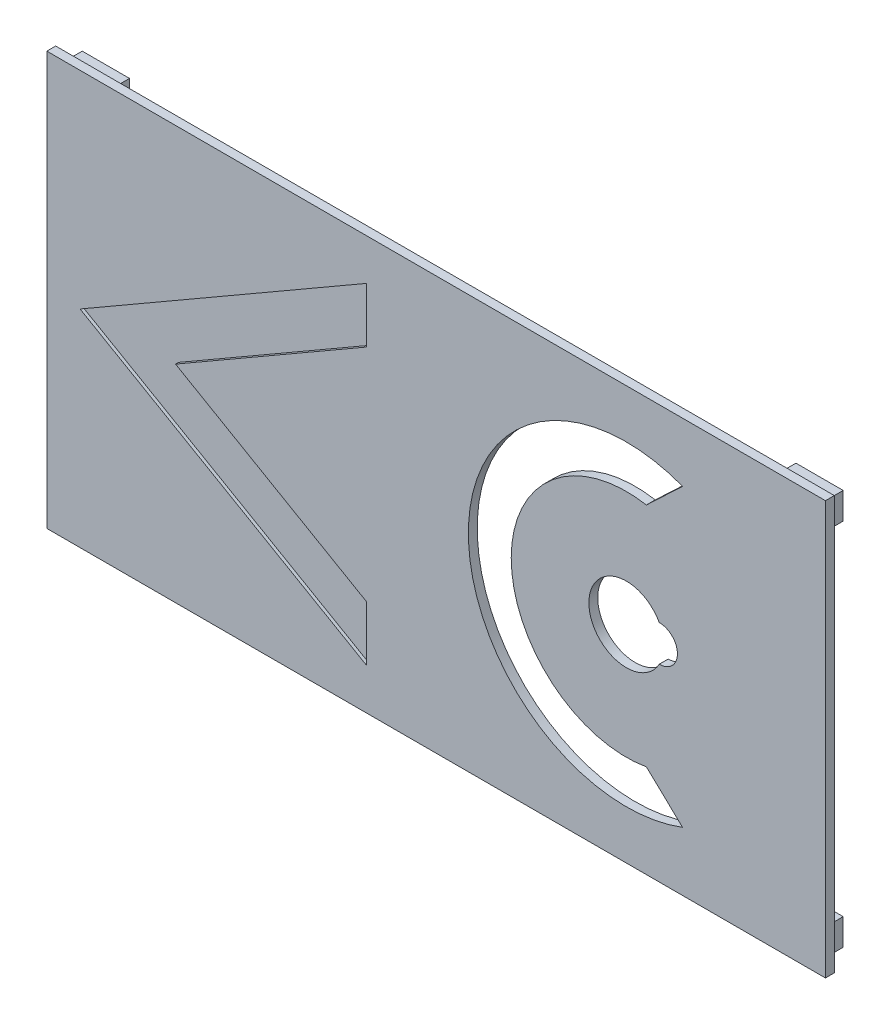
from build123d import *

# Parameters (mm, degrees)
SKETCH1_W                 = 131.85
SKETCH1_H                 = 70
BOSS_EXTRUDE1_DEPTH       = 1.5
CUT_EXTRUDE1_REACH        = 137.268
SKETCH4_W                 = 8
SKETCH4_H                 = 4.5
SKETCH4_W_2               = 5
SKETCH4_H_2               = 1.5
BOSS_EXTRUDE2_DEPTH       = 3
MIRROR2_COPY_1_SKETCH_W   = 8
MIRROR2_COPY_1_SKETCH_H   = 4.5
MIRROR2_COPY_1_SKETCH_W_2 = 5
MIRROR2_COPY_1_SKETCH_H_2 = 1.5
MIRROR2_COPY_1_DEPTH      = 3
CUT_EXTRUDE2_REACH        = 137.335
CUT_EXTRUDE3_DEPTH        = 0.5


with BuildPart() as part:
    # Sketch1 → Boss-Extrude1 (new body)
    with BuildSketch(Plane.XY):
        with Locations((55.175, 25.25)):
            Rectangle(SKETCH1_W, SKETCH1_H)
    extrude(amount=BOSS_EXTRUDE1_DEPTH)

    # Sketch2 → Cut-Extrude1 (cut, up to next)
    with BuildSketch(Plane.XY.offset(1.5), mode=Mode.PRIVATE) as cut_extrude1_sk1:
        with BuildLine():
            Line((92.957060126, 22.2), (92.9875, 22.2))
            ThreePointArc((92.9875, 22.2), (96.0375, 25.25), (92.9875, 28.3))
            Line((92.9875, 28.3), (92.957060126, 28.3))
            ThreePointArc((92.957060126, 28.3), (81.0375, 25.25), (92.957060126, 22.2))
        make_face()
    cut_extrude1_tool1 = extrude(cut_extrude1_sk1.sketch, amount=-CUT_EXTRUDE1_REACH, mode=Mode.PRIVATE) & part.part
    add(cut_extrude1_tool1.solids().sort_by_distance((87.98685, 25.25, 1.5))[0], mode=Mode.SUBTRACT)

    # Sketch4 → Boss-Extrude2 (add)
    with BuildSketch(Plane(origin=(0, 0, 0), x_dir=(-1, 0, 0), z_dir=(0, 0, -1))):
        with Locations((-115.6, 56.5)):
            Rectangle(SKETCH4_W, SKETCH4_H)
        with Locations((-115.6, 56.5)):
            Rectangle(SKETCH4_W_2, SKETCH4_H_2, mode=Mode.SUBTRACT)
    boss_extrude2 = extrude(amount=BOSS_EXTRUDE2_DEPTH)

    # Mirror1: Boss-Extrude2 across plane
    add(boss_extrude2.mirror(Plane.ZX.offset(25.25)))

    # Mirror2: Boss-Extrude2 across plane
    add(boss_extrude2.mirror(Plane(origin=(55.175, 0, 0), x_dir=(0, 0, 1), z_dir=(1, 0, 0))))

    # Mirror2 copy 1 sketch → Mirror2 copy 1 (add)
    with BuildSketch(Plane(origin=(110.35, 50.5, 0), x_dir=(1, 0, 0), z_dir=(0, 0, -1))):
        with Locations((-115.6, 56.5)):
            Rectangle(MIRROR2_COPY_1_SKETCH_W, MIRROR2_COPY_1_SKETCH_H)
        with Locations((-115.6, 56.5)):
            Rectangle(MIRROR2_COPY_1_SKETCH_W_2, MIRROR2_COPY_1_SKETCH_H_2, mode=Mode.SUBTRACT)
    extrude(amount=MIRROR2_COPY_1_DEPTH)

    # Sketch5 → Cut-Extrude2 (cut, up to next)
    with BuildSketch(Plane.XY.offset(1.5), mode=Mode.PRIVATE) as cut_extrude2_sk1:
        with BuildLine():
            Line((90.774215328, 6.046350365), (96.908092333, 0.244034279))
            ThreePointArc((96.908092333, 0.244034279), (60.630444856, 25.25), (96.908092333, 50.255965721))
            Line((96.908092333, 50.255965721), (90.774215328, 44.453649635))
            ThreePointArc((90.774215328, 44.453649635), (67.8875, 25.25), (90.774215328, 6.046350365))
        make_face()
    cut_extrude2_tool1 = extrude(cut_extrude2_sk1.sketch, amount=-CUT_EXTRUDE2_REACH, mode=Mode.PRIVATE) & part.part
    add(cut_extrude2_tool1.solids().sort_by_distance((61.276961, 25.25, 1.5))[0], mode=Mode.SUBTRACT)

    # Sketch6 → Cut-Extrude3 (cut)
    with BuildSketch(Plane.XY.offset(1.5)):
        Polygon((-5.119922612, 25.25), (43.3775, -2.75), (43.3775, 6.583333333), (11.045884925, 25.25), (43.3775, 43.916666667), (43.3775, 53.25), align=None)
    extrude(amount=-CUT_EXTRUDE3_DEPTH, mode=Mode.SUBTRACT)


solid = part.part
